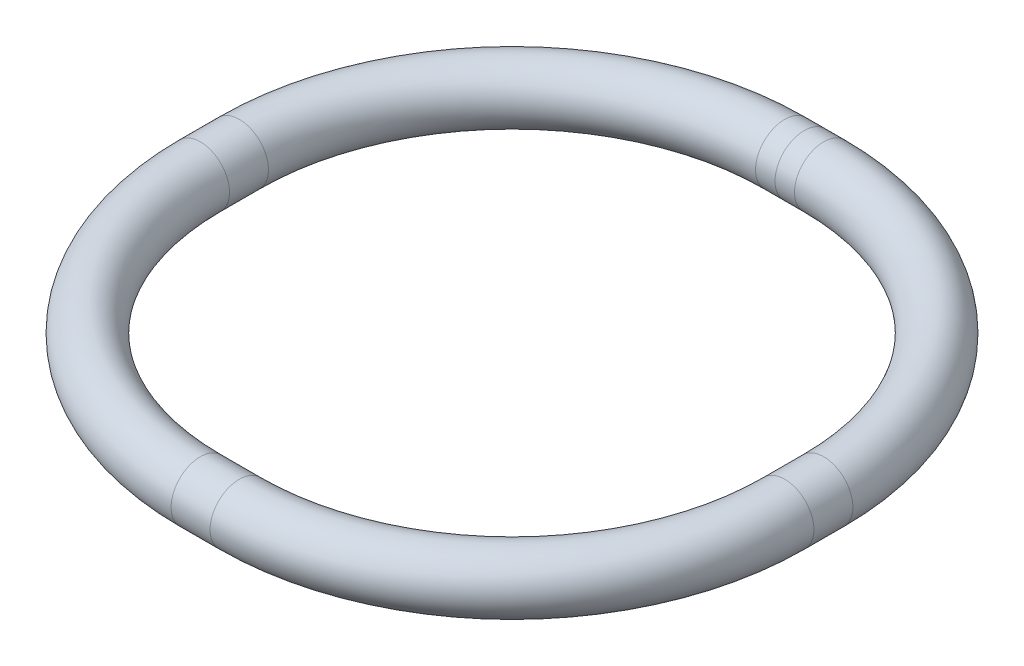
from build123d import *

# Parameters (mm, degrees)
SKETCH2_R = 0.75


with BuildPart() as part:
    # Sweep1: sweep along a path in Sketch1
    with BuildLine(Plane(origin=(0, 0, 0), x_dir=(1, 0, 0), z_dir=(0, 1, 0))) as sweep1_path:
        Line((-0.5, -7.5), (0.5, -7.5))
        ThreePointArc((0.5, -7.5), (5.449747468, -5.449747468), (7.5, -0.5))
        Line((7.5, -0.5), (7.5, 0.5))
        ThreePointArc((7.5, 0.5), (5.449747468, 5.449747468), (0.5, 7.5))
        Line((0.5, 7.5), (-0.5, 7.5))
        ThreePointArc((-0.5, 7.5), (-5.449747468, 5.449747468), (-7.5, 0.5))
        Line((-7.5, 0.5), (-7.5, -0.5))
        ThreePointArc((-7.5, -0.5), (-5.449747468, -5.449747468), (-0.5, -7.5))
    # Sketch2 → Sweep1 (sweep)
    with BuildSketch(Plane(origin=(0, 0, 0), x_dir=(0, 0, -1), z_dir=(1, 0, 0))):
        with Locations((7.5, 0)):
            Circle(SKETCH2_R)
    sweep(path=sweep1_path.line)


solid = part.part
